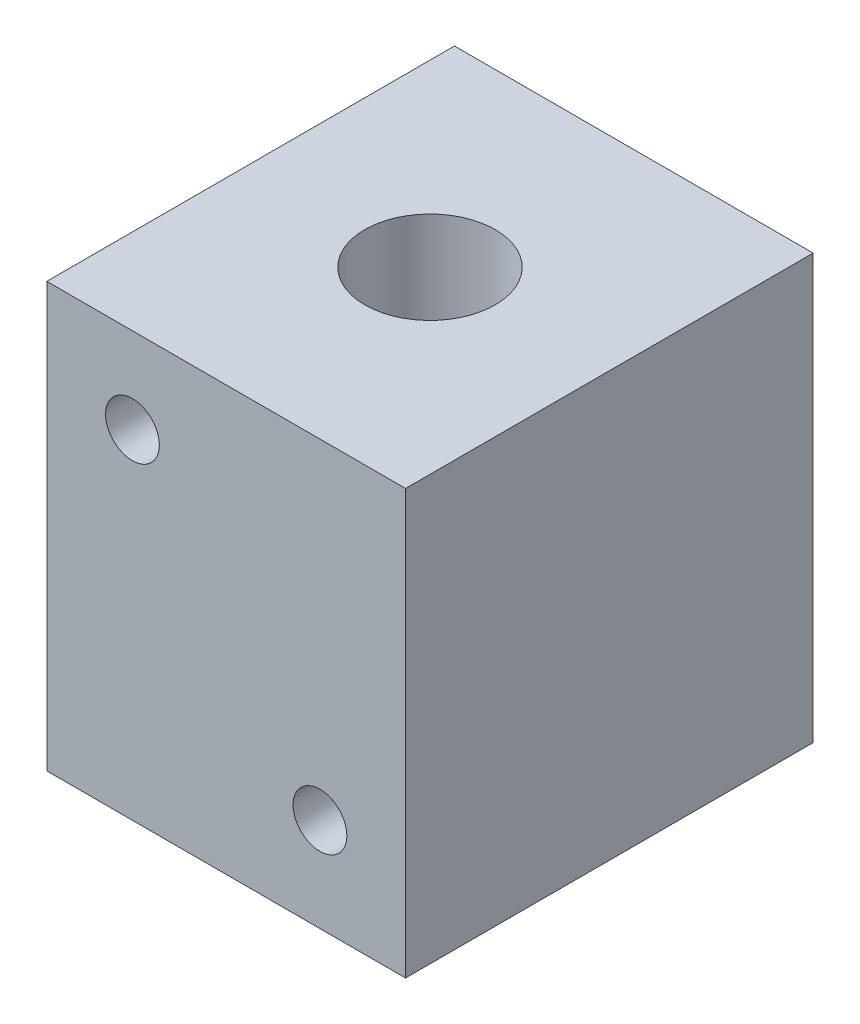
from build123d import *

# Parameters (mm, degrees)
SKETCH1_W           = 22
SKETCH1_H           = 25
BOSS_EXTRUDE1_DEPTH = 26
SKETCH2_R           = 4
CUT_EXTRUDE2_DEPTH  = 17
SKETCH3_R           = 1.65
CUT_EXTRUDE3_DEPTH  = 10


with BuildPart() as part:
    # Sketch1 → Boss-Extrude1 (new body)
    with BuildSketch(Plane(origin=(0, 0, 0), x_dir=(1, 0, 0), z_dir=(0, 1, 0))):
        Rectangle(SKETCH1_W, SKETCH1_H)
    extrude(amount=BOSS_EXTRUDE1_DEPTH)

    # Sketch2 → Cut-Extrude2 (cut)
    with BuildSketch(Plane(origin=(0, 26, 0), x_dir=(1, 0, 0), z_dir=(0, 1, 0))):
        with Locations(Location((0, 0, 0), (0, 0, 270))):
            Circle(SKETCH2_R)
    extrude(amount=-CUT_EXTRUDE2_DEPTH, mode=Mode.SUBTRACT)

    # Sketch3 → Cut-Extrude3 (cut)
    with BuildSketch(Plane.XY.offset(12.5)):
        with Locations((-5.75, 20.75)):
            Circle(SKETCH3_R)
        with Locations((5.75, 5.75)):
            Circle(SKETCH3_R)
    extrude(amount=-CUT_EXTRUDE3_DEPTH, mode=Mode.SUBTRACT)


solid = part.part
